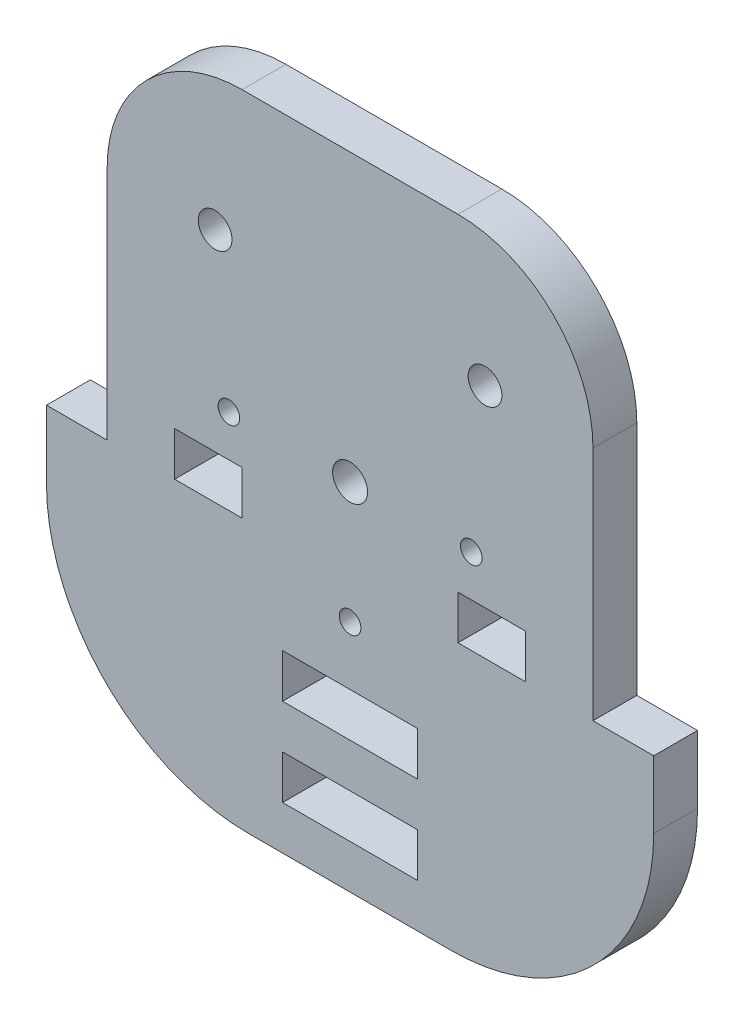
from build123d import *

# Parameters (mm, degrees)
BOSS_EXTRUDE1_DEPTH = 6.5
FILLET1_R           = 20
FILLET2_R           = 30
SKETCH2_R           = 1.6
SKETCH2_R_2         = 2.5
SKETCH2_R_3         = 2.59056518
MOUNT_HOLES_DEPTH   = 132.02385279
SIDEWHEEL_CUT_REACH = 133.024
SKETCH3_W           = 10
SKETCH3_H           = 6.5
SKETCH4_W           = 20
SKETCH4_H           = 6.5
CROSSBAR_CUT_DEPTH  = 132.02385279


with BuildPart() as part:
    # Sketch1 → Boss-Extrude1 (new body)
    with BuildSketch(Plane.XY):
        Polygon((0, 40), (0, 0), (90, 0), (90, 40), (81, 40), (81, 95), (9, 95), (9, 40), align=None)
    extrude(amount=BOSS_EXTRUDE1_DEPTH)

    # Fillet1
    fillet1_edges = [part.edges().sort_by_distance(p)[0] for p in [
        (81, 95, 3.25),
        (9, 95, 3.25),
    ]]
    fillet(fillet1_edges, radius=FILLET1_R)

    # Fillet2
    fillet2_edges = [part.edges().sort_by_distance(p)[0] for p in [
        (90, 0, 3.25),
        (0, 0, 3.25),
    ]]
    fillet(fillet2_edges, radius=FILLET2_R)

    # Sketch2 → mount holes (cut, through all)
    with BuildSketch(Plane.XY.offset(6.5)):
        with Locations((62.960512242, 52.639320225)):
            Circle(SKETCH2_R)
        with Locations((27.039487758, 52.639320225)):
            Circle(SKETCH2_R)
        with Locations((45, 34.678807983)):
            Circle(SKETCH2_R)
        with Locations((25, 75)):
            Circle(SKETCH2_R_2)
        with Locations((65, 75)):
            Circle(SKETCH2_R_2)
        with Locations((45, 52.639320225)):
            Circle(SKETCH2_R_3)
    extrude(amount=-MOUNT_HOLES_DEPTH, mode=Mode.SUBTRACT)

    # Sketch3 → sidewheel cut (cut, up to next)
    with BuildSketch(Plane.XY.offset(6.5), mode=Mode.PRIVATE) as sidewheel_cut_sk1:
        with Locations((24, 43.25)):
            Rectangle(SKETCH3_W, SKETCH3_H)
    sidewheel_cut_tool1 = extrude(sidewheel_cut_sk1.sketch, amount=-SIDEWHEEL_CUT_REACH, mode=Mode.PRIVATE) & part.part
    # Sketch3 → sidewheel cut (cut, up to next)
    with BuildSketch(Plane.XY.offset(6.5), mode=Mode.PRIVATE) as sidewheel_cut_sk2:
        with Locations((66, 43.25)):
            Rectangle(SKETCH3_W, SKETCH3_H)
    sidewheel_cut_tool2 = extrude(sidewheel_cut_sk2.sketch, amount=-SIDEWHEEL_CUT_REACH, mode=Mode.PRIVATE) & part.part
    add(sidewheel_cut_tool1.solids().sort_by_distance((24, 43.25, 6.5))[0], mode=Mode.SUBTRACT)
    add(sidewheel_cut_tool2.solids().sort_by_distance((66, 43.25, 6.5))[0], mode=Mode.SUBTRACT)

    # Sketch4 → crossbar cut (cut, through all)
    with BuildSketch(Plane.XY.offset(6.5)):
        with Locations((45, 22.75)):
            Rectangle(SKETCH4_W, SKETCH4_H)
        with Locations((45, 9.75)):
            Rectangle(SKETCH4_W, SKETCH4_H)
    extrude(amount=-CROSSBAR_CUT_DEPTH, mode=Mode.SUBTRACT)


solid = part.part
